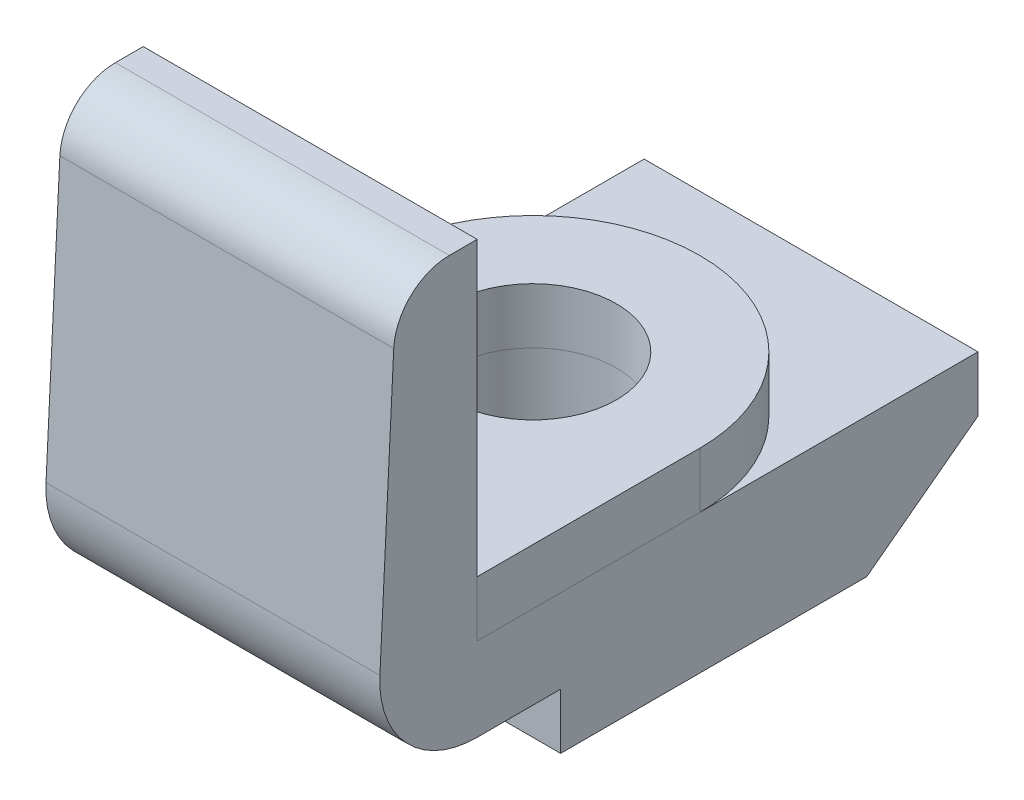
from build123d import *

# Parameters (mm, degrees)
EXTRUDE_1_DEPTH     = 76.2
SKETCH_1_R          = 19.05
EXTRUDE_2_DEPTH     = 12.7
SKETCH_2_R          = 19.05
CUT_EXTRUDE_1_DEPTH = 48.514


with BuildPart() as part:
    # Sketch 3D_1 → 凸台-拉伸1 (new body)
    with BuildSketch(Plane(origin=(0, -31.75, -19.05), x_dir=(0, 0.9748585065718673, 0.22282480150214104), z_dir=(-1, 0, 0))):
        with BuildLine():
            Line((0, 0), (-15.564312385, 68.093866684))
            Line((-15.564312385, 68.093866684), (-2.653007793, 97.10008522))
            Line((-2.653007793, 97.10008522), (9.727695241, 99.929960199))
            Line((9.727695241, 99.929960199), (35.196570052, -11.496367103))
            Line((35.196570052, -11.496367103), (38.291745811, -10.788898358))
            Line((38.291745811, -10.788898358), (112.575964011, 6.190351517))
            Line((112.575964011, 6.190351517), (113.990901501, 0))
            ThreePointArc((113.990901501, 0), (112.531634737, -9.311559159), (105.057107567, -15.053164948))
            Line((105.057107567, -15.053164948), (44.323836735, -32.179655803))
            ThreePointArc((44.323836735, -32.179655803), (26.948798496, -29.90141183), (16.625515502, -15.741179571))
            Line((16.625515502, -15.741179571), (12.380703033, 2.829874979))
            Line((12.380703033, 2.829874979), (0, 0))
        make_face()
    extrude(amount=-EXTRUDE_1_DEPTH)

    # 草图2 → 切除-拉伸1 (cut)
    with BuildSketch(Plane(origin=(0, 0, 0), x_dir=(1, 0, 0), z_dir=(0, 1, 0))):
        with Locations(Location((38.1, 50.8, 0), (0, 0, 270))):
            Circle(SKETCH_2_R)
    extrude(amount=-CUT_EXTRUDE_1_DEPTH, mode=Mode.SUBTRACT)


with BuildPart() as body_2:
    # 草图1 → 凸台-拉伸2 (new body)
    with BuildSketch(Plane(origin=(0, 0, 0), x_dir=(1, 0, 0), z_dir=(0, 1, 0))):
        with BuildLine():
            Line((0, 0), (0, 50.8))
            ThreePointArc((0, 50.8), (38.1, 88.9), (76.2, 50.8))
            Line((76.2, 50.8), (76.2, 0))
            Line((76.2, 0), (0, 0))
        make_face()
        with Locations(Location((38.1, 50.8, 0), (0, 0, 270))):
            Circle(SKETCH_1_R, mode=Mode.SUBTRACT)
    extrude(amount=EXTRUDE_2_DEPTH)


solid = Compound([part.part, body_2.part])
